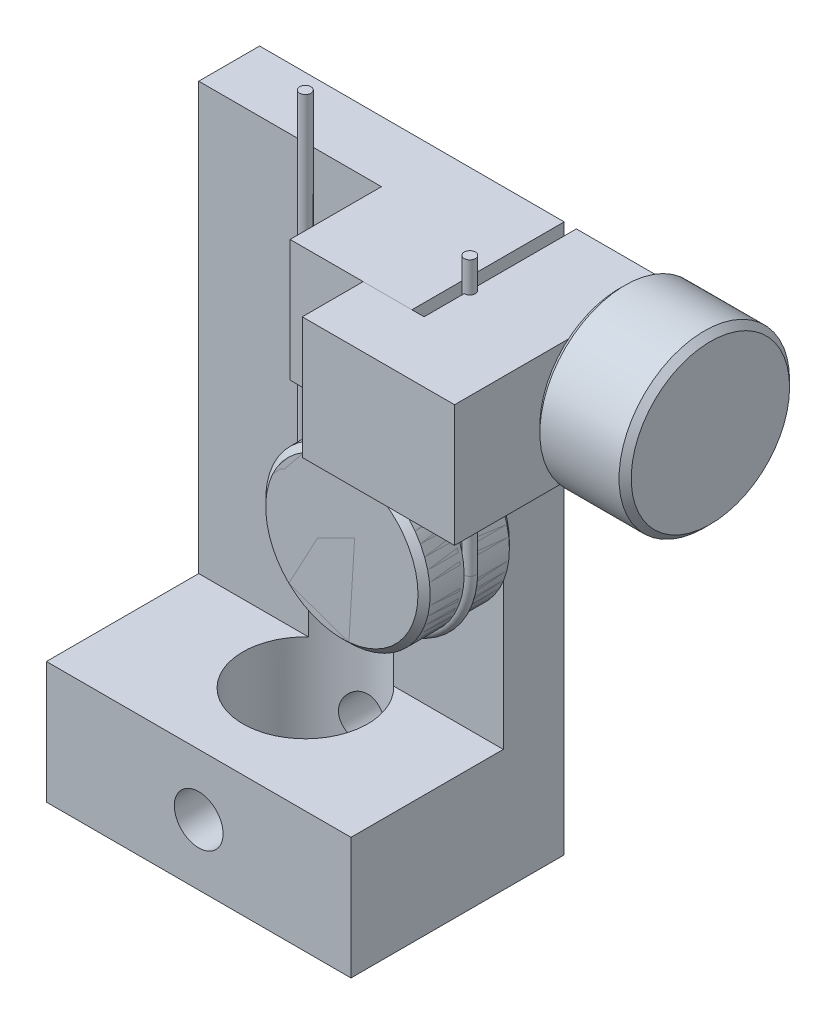
from build123d import *

# Parameters (mm, degrees)
SKETCH1_W               = 50
SKETCH1_H               = 90
BOSS_EXTRUDE1_DEPTH     = 10
SKETCH2_W               = 50
SKETCH2_H               = 20
BOSS_EXTRUDE2_DEPTH     = 25
CUT_EXTRUDE1_DEPTH      = 5
CUT_EXTRUDE1_DEPTH_BACK = 83.158383626
SKETCH3_R               = 10.25
SKETCH4_R               = 4
CUT_EXTRUDE2_DEPTH      = 63.24949799
SKETCH5_R               = 4.25
CUT_EXTRUDE3_DEPTH      = 30
SKETCH5_3_W             = 20
SKETCH5_3_H             = 20
BOSS_EXTRUDE3_DEPTH     = 15
SKETCH9_W               = 15
SKETCH9_H               = 25
BOSS_EXTRUDE4_DEPTH     = 20
SKETCH10_R              = 4.25
CUT_EXTRUDE4_DEPTH      = 27
SKETCH10_3_R            = 5
SKETCH10_3_R_2          = 4.25
CUT_EXTRUDE5_DEPTH      = 15
SKETCH14_R              = 13.5
BOSS_EXTRUDE5_DEPTH     = 15
SKETCH14_5_R            = 4.925
SKETCH14_5_R_2          = 4.25
BOSS_EXTRUDE8_DEPTH     = 10
SKETCH19_R              = 4.925
SKETCH19_R_2            = 4.25
BOSS_EXTRUDE7_DEPTH     = 15
SKETCH19_3_R            = 4.925
SKETCH19_3_R_2          = 4.25
BOSS_EXTRUDE9_DEPTH     = 10
CHAMFER1_SIZE           = 1
CHAMFER2_SIZE           = 1
SKETCH26_R              = 14
BOSS_EXTRUDE10_DEPTH    = 15
SKETCH27_R              = 4.925
BOSS_EXTRUDE11_DEPTH    = 27
SKETCH29_W              = 16
SKETCH29_H              = 0.925
CHAMFER3_SIZE           = 1
BOSS_EXTRUDE12_DEPTH    = 20
SKETCH32_R              = 0.925


with BuildPart() as part:
    # Sketch1 → Boss-Extrude1 (new body)
    with BuildSketch(Plane.XY):
        Rectangle(SKETCH1_W, SKETCH1_H)
    extrude(amount=BOSS_EXTRUDE1_DEPTH)

    # Sketch2 → Boss-Extrude2 (add)
    with BuildSketch(Plane.XY.offset(10)):
        with Locations((0, -35)):
            Rectangle(SKETCH2_W, SKETCH2_H)
    extrude(amount=BOSS_EXTRUDE2_DEPTH)

    # Sketch3 → Cut-Extrude1 (cut, two sides: drawn at the far end of the back side and taken through both)
    with BuildSketch(Plane(origin=(0, -25, 0), x_dir=(1, 0, 0), z_dir=(0, 1, 0)).offset(-CUT_EXTRUDE1_DEPTH_BACK)):
        with Locations(Location((0, -17.5, 0), (0, 0, 47.029716068))):
            Circle(SKETCH3_R)
    extrude(amount=CUT_EXTRUDE1_DEPTH + CUT_EXTRUDE1_DEPTH_BACK, mode=Mode.SUBTRACT)

    # Sketch4 → Cut-Extrude2 (cut, through all)
    with BuildSketch(Plane.XY.offset(35)):
        with Locations((0, -35)):
            Circle(SKETCH4_R)
    extrude(amount=-CUT_EXTRUDE2_DEPTH, mode=Mode.SUBTRACT)

    # Sketch5 → Cut-Extrude3 (cut)
    with BuildSketch(Plane.XY.offset(10)):
        with Locations((13.5, 5)):
            Circle(SKETCH5_R)
    extrude(amount=-CUT_EXTRUDE3_DEPTH, mode=Mode.SUBTRACT)

    # Sketch5<3> → Boss-Extrude3 (add)
    with BuildSketch(Plane.XY.offset(10)):
        with Locations((15, 35)):
            Rectangle(SKETCH5_3_W, SKETCH5_3_H)
    extrude(amount=BOSS_EXTRUDE3_DEPTH)


with BuildPart() as body_2:
    # Sketch9 → Boss-Extrude4 (new body)
    with BuildSketch(Plane(origin=(0, 45, 0), x_dir=(1, 0, 0), z_dir=(0, 1, 0))):
        with Locations((34.5, -12.5)):
            Rectangle(SKETCH9_W, SKETCH9_H)
    extrude(amount=-BOSS_EXTRUDE4_DEPTH)


with BuildPart() as cut_extrude4_tool:
    # Sketch10 → Cut-Extrude4 (new body)
    with BuildSketch(Plane(origin=(42, 0, 0), x_dir=(0, 0, -1), z_dir=(1, 0, 0))):
        with Locations((-8, 35)):
            Circle(SKETCH10_R)
    extrude(amount=-CUT_EXTRUDE4_DEPTH)


with BuildPart() as part_1:
    add(part.part)

    # Cut-Extrude4: cut by cut_extrude4_tool
    add(cut_extrude4_tool.part, mode=Mode.SUBTRACT)

    # Sketch23 → Ø1.0mm Dowel Hole1 (revolve, cut)
    with BuildSketch(Plane(origin=(15, 35, 8), x_dir=(0, 0, -1), z_dir=(0, 1, 0))):
        Polygon((0, 0), (0, 7.553657631), (4.25, 5), (4.25, 0), align=None)
    revolve(axis=Axis((21.35, 35, 8), (-1, 0, 0)), mode=Mode.SUBTRACT)


with BuildPart() as body_2_1:
    add(body_2.part)

    # Cut-Extrude4: cut by cut_extrude4_tool
    add(cut_extrude4_tool.part, mode=Mode.SUBTRACT)

    # Sketch10<3> → Cut-Extrude5 (cut)
    with BuildSketch(Plane(origin=(42, 0, 0), x_dir=(0, 0, -1), z_dir=(1, 0, 0))):
        with Locations((-8, 35)):
            Circle(SKETCH10_3_R)
        with Locations((-8, 35)):
            Circle(SKETCH10_3_R_2, mode=Mode.SUBTRACT)
    extrude(amount=-CUT_EXTRUDE5_DEPTH, mode=Mode.SUBTRACT)

    # Sketch31 → Boss-Extrude12 (add)
    with BuildSketch(Plane(origin=(0, 45, 0), x_dir=(1, 0, 0), z_dir=(0, 1, 0))):
        Polygon((27, -25), (17, -25), (17, -35), (42, -35), (42, -25), align=None)
    extrude(amount=-BOSS_EXTRUDE12_DEPTH)


with BuildPart() as body_3:
    # Sketch14 → Boss-Extrude5 (new body)
    with BuildSketch(Plane.XY.offset(10)):
        with Locations((13.5, 5)):
            Circle(SKETCH14_R)
    extrude(amount=BOSS_EXTRUDE5_DEPTH)

    # Sketch14<5> → Boss-Extrude8 (add)
    # profile 1 of 2: a face of its own
    with BuildSketch(Plane.XY.offset(10)):
        with Locations((13.5, 5)):
            Circle(SKETCH14_5_R)
        with Locations((13.5, 5)):
            Circle(SKETCH14_5_R_2, mode=Mode.SUBTRACT)
    # profile 2 of 2: a face of its own
    with BuildSketch(Plane.XY.offset(10)):
        with Locations((13.5, 5)):
            Circle(SKETCH14_5_R_2)
    extrude(amount=-BOSS_EXTRUDE8_DEPTH)

    # Sketch17 → Cut-Revolve1 (revolve, cut)
    with BuildSketch(Plane(origin=(0, 5, 0), x_dir=(-1, 0, 0), z_dir=(0, 1, 0)), mode=Mode.PRIVATE) as cut_revolve1_sk:
        with BuildLine():
            Line((0, 18.425), (0, 16.575))
            ThreePointArc((0, 16.575), (-0.925, 17.5), (0, 18.425))
        make_face()
    revolve(cut_revolve1_sk.sketch.rotate(Axis((13.5, 5, 25), (0, 0, -1)), 180), axis=Axis((13.5, 5, 25), (0, 0, -1)), mode=Mode.SUBTRACT)

    # Sketch24 → Cut-Revolve3 (revolve, cut)
    with BuildSketch(Plane(origin=(0, 5, 0), x_dir=(-1, 0, 0), z_dir=(0, 1, 0)), mode=Mode.PRIVATE) as cut_revolve3_sk:
        with BuildLine():
            Line((-8.575, 10), (-8.575, 8))
            ThreePointArc((-8.575, 8), (-9.575, 9), (-8.575, 10))
        make_face()
    revolve(cut_revolve3_sk.sketch.rotate(Axis((13.5, 5, 9), (0, 0, -1)), 180), axis=Axis((13.5, 5, 9), (0, 0, -1)), mode=Mode.SUBTRACT)

    # Chamfer1
    chamfer1_edges = [body_3.edges().sort_by_distance(p)[0] for p in [
        (0, 5, 10),
        (8.575, 5, 0),
        (0, 5, 25),
    ]]
    chamfer(chamfer1_edges, length=CHAMFER1_SIZE)

    # Sweep1: sweep along a path in Sketch33
    with BuildLine(Plane.XY.offset(17.5)) as sweep1_path:
        Line((27, 50), (27, 5))
        ThreePointArc((27, 5), (13.5, -8.5), (0, 5))
        Line((0, 5), (0, 60))
    # Sketch32 → Sweep1 (sweep)
    with BuildSketch(Plane(origin=(0, 50, 0), x_dir=(1, 0, 0), z_dir=(0, 1, 0))):
        with Locations((27, -17.5)):
            Circle(SKETCH32_R)
    sweep(path=sweep1_path.line)


with BuildPart() as body_4:
    # Sketch19 → Boss-Extrude7 (new body)
    # profile 1 of 4: a face of its own
    with BuildSketch(Plane.XY.offset(10)):
        with BuildLine():
            ThreePointArc((25, -2.071067812), (26.490381057, 1.325765386), (27, 5))
            ThreePointArc((27, 5), (26.490381057, 8.674234614), (25, 12.071067812))
            Line((25, 12.071067812), (25, -2.071067812))
        make_face()
    # profile 2 of 4: a face of its own
    with BuildSketch(Plane.XY.offset(10)):
        with BuildLine():
            Line((25, -2.071067812), (25, 12.071067812))
            ThreePointArc((25, 12.071067812), (0, 5), (25, -2.071067812))
        make_face()
        with Locations((13.5, 5)):
            Circle(SKETCH19_R, mode=Mode.SUBTRACT)
    # profile 3 of 4: a face of its own
    with BuildSketch(Plane.XY.offset(10)):
        with Locations((13.5, 5)):
            Circle(SKETCH19_R)
        with Locations((13.5, 5)):
            Circle(SKETCH19_R_2, mode=Mode.SUBTRACT)
    # profile 4 of 4: a face of its own
    with BuildSketch(Plane.XY.offset(10)):
        with Locations((13.5, 5)):
            Circle(SKETCH19_R_2)
    extrude(amount=BOSS_EXTRUDE7_DEPTH)

    # Sketch19<3> → Boss-Extrude9 (add)
    # profile 1 of 2: a face of its own
    with BuildSketch(Plane.XY.offset(10)):
        with Locations((13.5, 5)):
            Circle(SKETCH19_3_R)
        with Locations((13.5, 5)):
            Circle(SKETCH19_3_R_2, mode=Mode.SUBTRACT)
    # profile 2 of 2: a face of its own
    with BuildSketch(Plane.XY.offset(10)):
        with Locations((13.5, 5)):
            Circle(SKETCH19_3_R_2)
    extrude(amount=-BOSS_EXTRUDE9_DEPTH)

    # Sketch20 → Cut-Revolve2 (revolve, cut)
    with BuildSketch(Plane(origin=(0, 5, 0), x_dir=(-1, 0, 0), z_dir=(0, 1, 0)), mode=Mode.PRIVATE) as cut_revolve2_sk:
        with BuildLine():
            Line((0, 18.975), (0, 16.025))
            ThreePointArc((0, 16.025), (-1.475, 17.5), (0, 18.975))
        make_face()
    revolve(cut_revolve2_sk.sketch.rotate(Axis((13.5, 5, 25), (0, 0, -1)), 180), axis=Axis((13.5, 5, 25), (0, 0, -1)), mode=Mode.SUBTRACT)

    # Chamfer2
    chamfer2_edges = [body_4.edges().sort_by_distance(p)[0] for p in [
        (2, 12.071067812, 25),
        (8.575, 5, 0),
        (2, 12.071067812, 10),
    ]]
    chamfer(chamfer2_edges, length=CHAMFER2_SIZE)

    # Sketch25 → Cut-Revolve4 (revolve, cut)
    with BuildSketch(Plane(origin=(0, 5, 0), x_dir=(-1, 0, 0), z_dir=(0, 1, 0)), mode=Mode.PRIVATE) as cut_revolve4_sk:
        with BuildLine():
            Line((-8.575, 10), (-8.575, 8))
            ThreePointArc((-8.575, 8), (-9.575, 9), (-8.575, 10))
        make_face()
    revolve(cut_revolve4_sk.sketch.rotate(Axis((13.5, 5, 9), (0, 0, -1)), 180), axis=Axis((13.5, 5, 9), (0, 0, -1)), mode=Mode.SUBTRACT)


with BuildPart() as body_5:
    # Sketch26 → Boss-Extrude10 (new body)
    with BuildSketch(Plane(origin=(42, 0, 0), x_dir=(0, 0, -1), z_dir=(1, 0, 0))):
        with Locations((-8, 35)):
            Circle(SKETCH26_R)
    extrude(amount=BOSS_EXTRUDE10_DEPTH)

    # Sketch27 → Boss-Extrude11 (add)
    with BuildSketch(Plane.ZY.offset(-42)):
        with Locations((8, 35)):
            Circle(SKETCH27_R)
    extrude(amount=BOSS_EXTRUDE11_DEPTH)

    # Sketch29 → Cut-Revolve5 (revolve, cut)
    with BuildSketch(Plane(origin=(0, 35, 0), x_dir=(-1, 0, 0), z_dir=(0, 1, 0)), mode=Mode.PRIVATE) as cut_revolve5_sk:
        with Locations((-34, 12.4625)):
            Rectangle(SKETCH29_W, SKETCH29_H)
    revolve(cut_revolve5_sk.sketch.rotate(Axis((57, 35, 8), (-1, 0, 0)), 90), axis=Axis((57, 35, 8), (-1, 0, 0)), mode=Mode.SUBTRACT)

    # Chamfer3
    chamfer3_edges = [body_5.edges().sort_by_distance(p)[0] for p in [
        (42, 35, 22),
        (57, 35, 22),
        (15, 35, 3.075),
    ]]
    chamfer(chamfer3_edges, length=CHAMFER3_SIZE)


solid = Compound([part_1.part, body_2_1.part, body_3.part, body_4.part, body_5.part])
